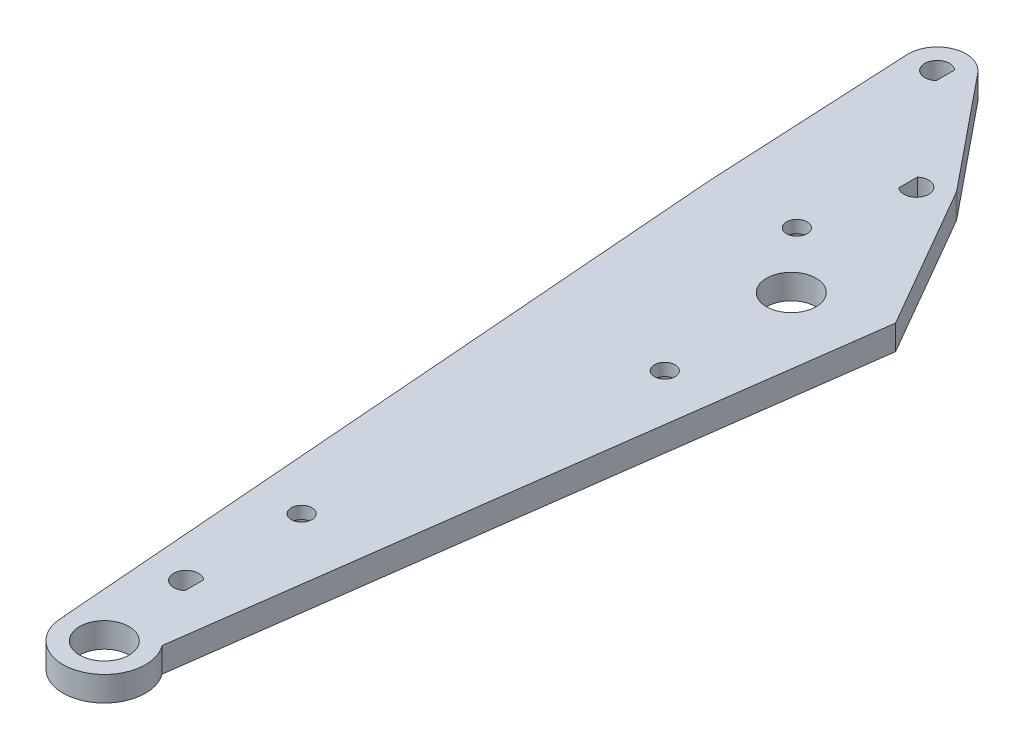
from build123d import *

# Parameters (mm, degrees)
SKETCH_2_R          = 3
EXTRUDE_1_DEPTH     = 3
SKETCH_3_R          = 3.5
EXTRUDE_2_DEPTH     = 3
SKETCH_4_R          = 3.5
EXTRUDE_3_DEPTH     = 3
CUT_EXTRUDE_1_DEPTH = 107.618473768
CUT_EXTRUDE_2_DEPTH = 107.618473768
EXTRUDE_4_DEPTH     = 3
SKETCH_6_R          = 1.25
CUT_EXTRUDE_3_DEPTH = 107.618473768
SKETCH_6_3_R        = 2
SKETCH_6_3_R_2      = 1.25
CUT_EXTRUDE_4_DEPTH = 1.5


with BuildPart() as part:
    # 草图2 → 凸台-拉伸1 (new body)
    with BuildSketch(Plane(origin=(0, 0, 0), x_dir=(1, 0, 0), z_dir=(0, 1, 0))):
        with BuildLine():
            Line((-8, 0), (-15.238247957, -15.382059892))
            Line((-15.238247957, -15.382059892), (-8.643699882, -100.125861646))
            Line((-8.643699882, -100.125861646), (-8.61301011, -100.126871188))
            ThreePointArc((-8.61301011, -100.126871188), (-3.780099648, -105.28855468), (1.381583844, -100.455644218))
            Line((1.381583844, -100.455644218), (1.399355455, -100.456228817))
            Line((1.399355455, -100.456228817), (10.979274058, -19.016660498))
            Line((10.979274058, -19.016660498), (1.010362938, -1.749999943))
            ThreePointArc((1.010362938, -1.749999943), (-0.270725971, -0.46891107), (-2.020725942, 0))
            Line((-2.020725942, 0), (-8, 0))
        make_face()
        with Locations(Location((-3.615713133, -100.291257703, 0), (0, 0, 270))):
            Circle(SKETCH_2_R, mode=Mode.SUBTRACT)
        with BuildLine():
            ThreePointArc((-3.020725942, -2.381966011), (-0.520725942, -3.5), (-3.020725942, -4.618033989))
            Line((-3.020725942, -4.618033989), (-3.020725942, -2.381966011))
        make_face(mode=Mode.SUBTRACT)
        with Locations(Location((1.451061426, -22.124978573, 0), (0, 0, 270))):
            Circle(SKETCH_2_R, mode=Mode.SUBTRACT)
    extrude(amount=EXTRUDE_1_DEPTH)

    # 草图4 → 凸台-拉伸3 (add)
    with BuildSketch(Plane.XZ):
        with Locations((-5, 89)):
            Circle(SKETCH_4_R)
    extrude(amount=-EXTRUDE_3_DEPTH)

    # 草图4<3> → 切除-拉伸1 (cut, through all)
    with BuildSketch(Plane.XZ):
        with BuildLine():
            ThreePointArc((-3.5, 89), (-3.60795306, 89.55875336), (-3.916273757, 90.037081207))
            Line((-3.916273757, 90.037081207), (-4.089754437, 87.807752956))
            ThreePointArc((-4.089754437, 87.807752956), (-3.655498541, 88.334931712), (-3.5, 89))
        make_face()
        with BuildLine():
            Line((-4.089754437, 87.807752956), (-3.916273757, 90.037081207))
            ThreePointArc((-3.916273757, 90.037081207), (-6.495478854, 89.116374378), (-4.089754437, 87.807752956))
        make_face()
    extrude(amount=-CUT_EXTRUDE_1_DEPTH, mode=Mode.SUBTRACT)

    # 草图4<4> → 切除-拉伸2 (cut, through all)
    with BuildSketch(Plane.XZ):
        with BuildLine():
            ThreePointArc((1.384286867, 100.291257703), (1.127703357, 98.710118873), (0.384286867, 97.291257703))
            Line((0.384286867, 97.291257703), (10.979274058, 19.016660498))
            Line((10.979274058, 19.016660498), (1.399355455, 100.456228817))
            Line((1.399355455, 100.456228817), (1.381583844, 100.455644218))
            ThreePointArc((1.381583844, 100.455644218), (1.383611066, 100.373462071), (1.384286867, 100.291257703))
        make_face()
    extrude(amount=-CUT_EXTRUDE_2_DEPTH, mode=Mode.SUBTRACT)



with BuildPart() as body_2:
    # 草图3 → 凸台-拉伸2 (new body)
    with BuildSketch(Plane.XZ):
        with Locations(Location((-13, -10, 0), (0, 0, 270))):
            Circle(SKETCH_3_R)
        with BuildLine():
            Line((-12, -8.881966011), (-12, -11.118033989))
            ThreePointArc((-12, -11.118033989), (-14.5, -10), (-12, -8.881966011))
        make_face(mode=Mode.SUBTRACT)
    extrude(amount=-EXTRUDE_2_DEPTH)


with BuildPart() as part_1:
    add(part.part)

    add(body_2.part)  # 凸台-拉伸4 merges body 2
    # 草图5 → 凸台-拉伸4 (add)
    with BuildSketch(Plane.XZ):
        with BuildLine():
            Line((-10.28463728, -12.208348998), (0.694636778, 1.291651002))
            Line((0.694636778, 1.291651002), (-8, 0))
            Line((-8, 0), (-15.238247957, 15.382059892))
            Line((-15.238247957, 15.382059892), (-16.495653764, -9.825630381))
            ThreePointArc((-16.495653764, -9.825630381), (-11.746385015, -6.732210308), (-10.28463728, -12.208348998))
        make_face()
        with BuildLine():
            Line((-4, 90.118033989), (-4, 87.881966011))
            ThreePointArc((-4, 87.881966011), (-3.5, 89), (-4, 90.118033989))
        make_face()
    extrude(amount=-EXTRUDE_4_DEPTH)

    # 草图6 → 切除-拉伸3 (cut, through all)
    with BuildSketch(Plane.XZ):
        with Locations(Location((-5, 15, 0), (0, 0, 270))):
            Circle(SKETCH_6_R)
        with Locations(Location((2, 38, 0), (0, 0, 270))):
            Circle(SKETCH_6_R)
        with Locations(Location((-5, 75, 0), (0, 0, 270))):
            Circle(SKETCH_6_R)
    extrude(amount=-CUT_EXTRUDE_3_DEPTH, mode=Mode.SUBTRACT)

    # 草图6<3> → 切除-拉伸4 (cut)
    # profile 1 of 3: a face of its own
    with BuildSketch(Plane.XZ):
        with Locations(Location((-5, 15, 0), (0, 0, 270))):
            Circle(SKETCH_6_3_R)
        with Locations(Location((-5, 15, 0), (0, 0, 270))):
            Circle(SKETCH_6_3_R_2, mode=Mode.SUBTRACT)
    # profile 2 of 3: a face of its own
    with BuildSketch(Plane.XZ):
        with Locations(Location((2, 38, 0), (0, 0, 270))):
            Circle(SKETCH_6_3_R)
        with Locations(Location((2, 38, 0), (0, 0, 270))):
            Circle(SKETCH_6_3_R_2, mode=Mode.SUBTRACT)
    # profile 3 of 3: a face of its own
    with BuildSketch(Plane.XZ):
        with Locations(Location((-5, 75, 0), (0, 0, 270))):
            Circle(SKETCH_6_3_R)
        with Locations(Location((-5, 75, 0), (0, 0, 270))):
            Circle(SKETCH_6_3_R_2, mode=Mode.SUBTRACT)
    extrude(amount=-CUT_EXTRUDE_4_DEPTH, mode=Mode.SUBTRACT)


solid = part_1.part
